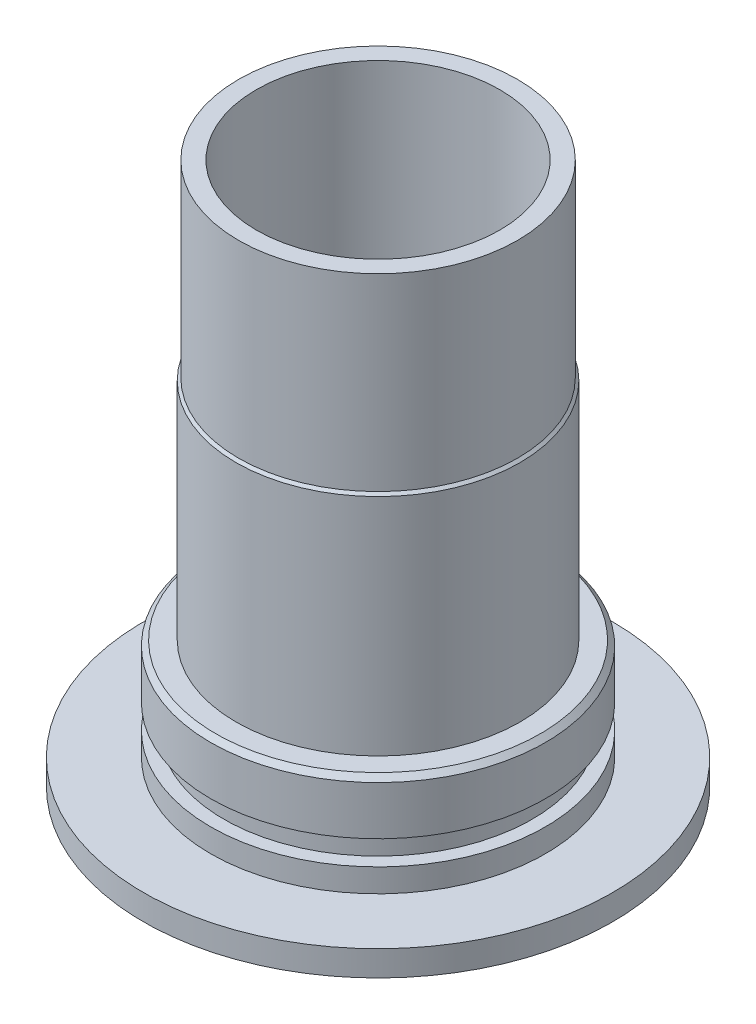
from build123d import *

# Parameters (mm, degrees)
SKETCH2_R          = 37.5
CUT_EXTRUDE1_DEPTH = 47


with BuildPart() as part:
    # Sketch1 → Revolve1 (revolve)
    with BuildSketch(Plane.XY, mode=Mode.PRIVATE) as revolve1_sk:
        Polygon((24, 154), (27.5, 154), (27.5, 69.8), (28, 69.3), (28, 25), (32, 25), (33, 24), (33, 14.4), (30.4, 14.4), (30.4, 9.6), (33, 9.6), (33, 5), (46.25, 5), (46.25, 0), (26.775, 0), (26.35, 0.5), (25.925, 0), (24, 0), align=None)
    revolve(revolve1_sk.sketch.rotate(Axis((0, 0, 0), (0, 1, 0)), 90), axis=Axis((0, 0, 0), (0, 1, 0)))

    # Sketch2 → Cut-Extrude1 (cut)
    with BuildSketch(Plane(origin=(0, 154, 0), x_dir=(1, 0, 0), z_dir=(0, 1, 0))):
        Circle(SKETCH2_R)
    extrude(amount=-CUT_EXTRUDE1_DEPTH, mode=Mode.SUBTRACT)


solid = part.part
